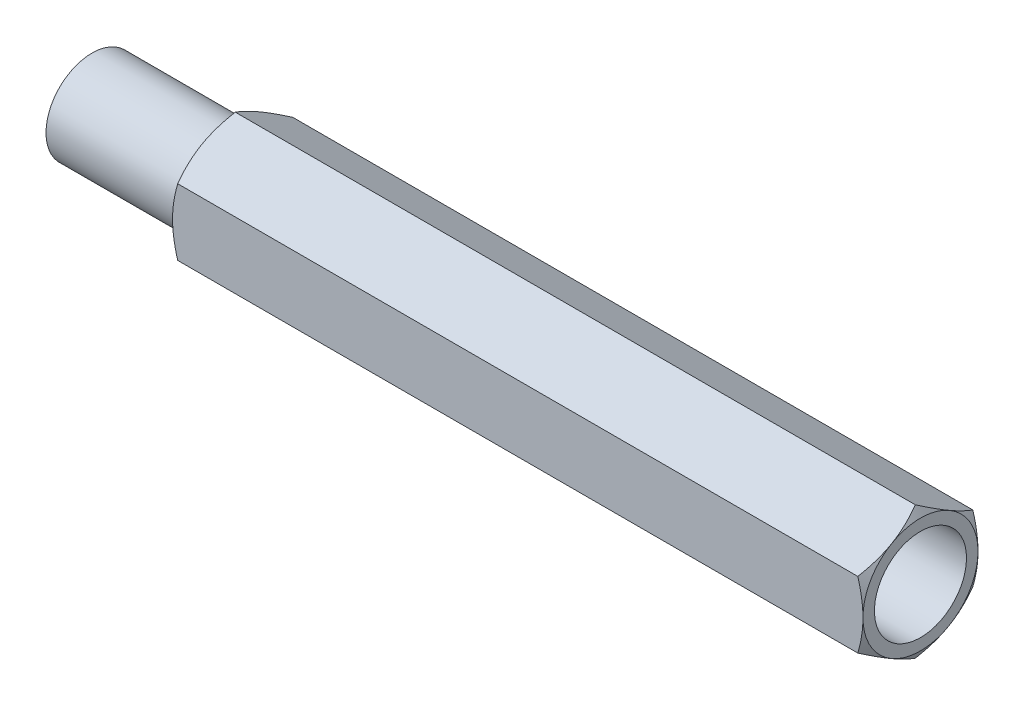
from build123d import *

# Parameters (mm, degrees)
EXTRUDE_START       = 6
EXTRUDE_1_DEPTH     = 30
SKETCH_4_R          = 32
SKETCH_4_R_2        = 2.5
CUT_EXTRUDE_1_DEPTH = 2
CUT_EXTRUDE_1_DRAFT = -60
SKETCH_5_R          = 32
SKETCH_5_R_2        = 2.5
CUT_EXTRUDE_2_DEPTH = 2
CUT_EXTRUDE_2_DRAFT = -60
SKETCH_6_W          = 6
SKETCH_6_H          = 2
EXTRUDE1_START      = -15
SKETCH1_R           = 2
EXTRUDE1_DEPTH      = 15


with BuildPart() as part:
    # 草图3 → 凸台-拉伸1 (new body)
    with BuildSketch(Plane(origin=(0, 0, 0), x_dir=(0, 0, -1), z_dir=(1, 0, 0)).offset(EXTRUDE_START)):
        Polygon((2.5, 1.443375673), (0, 2.886751346), (-2.5, 1.443375673), (-2.5, -1.443375673), (0, -2.886751346), (2.5, -1.443375673), align=None)
    extrude(amount=EXTRUDE_1_DEPTH)


with BuildPart() as cut_extrude_1_tool:
    # 草图4 → 切除-拉伸1 (with draft: the straight prism first)
    with BuildSketch(Plane.ZY.offset(-6)):
        Circle(SKETCH_4_R)
        Circle(SKETCH_4_R_2, mode=Mode.SUBTRACT)
    extrude(amount=-CUT_EXTRUDE_1_DEPTH)
    # 切除-拉伸1: the draft: its side faces are tilted about the plane it starts from
    cut_extrude_1_sides = [cut_extrude_1_tool.faces().sort_by_distance(p)[0] for p in [
        (7, 0, -32),
        (7, 0, -2.5),
    ]]
    draft(cut_extrude_1_sides, Plane.ZY.offset(-6), CUT_EXTRUDE_1_DRAFT)


with BuildPart() as part_1:
    add(part.part)

    # 切除-拉伸1: cut by cut_extrude_1_tool
    add(cut_extrude_1_tool.part, mode=Mode.SUBTRACT)


with BuildPart() as cut_extrude_2_tool:
    # 草图5 → 切除-拉伸2 (with draft: the straight prism first)
    with BuildSketch(Plane(origin=(36, 0, 0), x_dir=(0, 0, -1), z_dir=(1, 0, 0))):
        Circle(SKETCH_5_R)
        Circle(SKETCH_5_R_2, mode=Mode.SUBTRACT)
    extrude(amount=-CUT_EXTRUDE_2_DEPTH)
    # 切除-拉伸2: the draft: its side faces are tilted about the plane it starts from
    cut_extrude_2_sides = [cut_extrude_2_tool.faces().sort_by_distance(p)[0] for p in [
        (35, 0, 32),
        (35, 0, 2.5),
    ]]
    draft(cut_extrude_2_sides, Plane(origin=(36, 0, 0), x_dir=(0, 0, -1), z_dir=(1, 0, 0)), CUT_EXTRUDE_2_DRAFT)


with BuildPart() as part_2:
    add(part_1.part)

    # 切除-拉伸2: cut by cut_extrude_2_tool
    add(cut_extrude_2_tool.part, mode=Mode.SUBTRACT)

    # 草图6 → 旋转1 (revolve)
    with BuildSketch(Plane.XY, mode=Mode.PRIVATE) as revolve_1_sk:
        with Locations((3, 1)):
            Rectangle(SKETCH_6_W, SKETCH_6_H)
    revolve(revolve_1_sk.sketch.rotate(Axis((0, 0, 0), (1, 0, 0)), 90), axis=Axis((0, 0, 0), (1, 0, 0)))

    # Sketch1 → Extrude1 (cut)
    with BuildSketch(Plane(origin=(36, 0, 0), x_dir=(0, 0, -1), z_dir=(1, 0, 0)).offset(EXTRUDE1_START)):
        with Locations(Location((0, 0, 0), (0, 0, 180))):
            Circle(SKETCH1_R)
    extrude(amount=EXTRUDE1_DEPTH, mode=Mode.SUBTRACT)


solid = part_2.part
